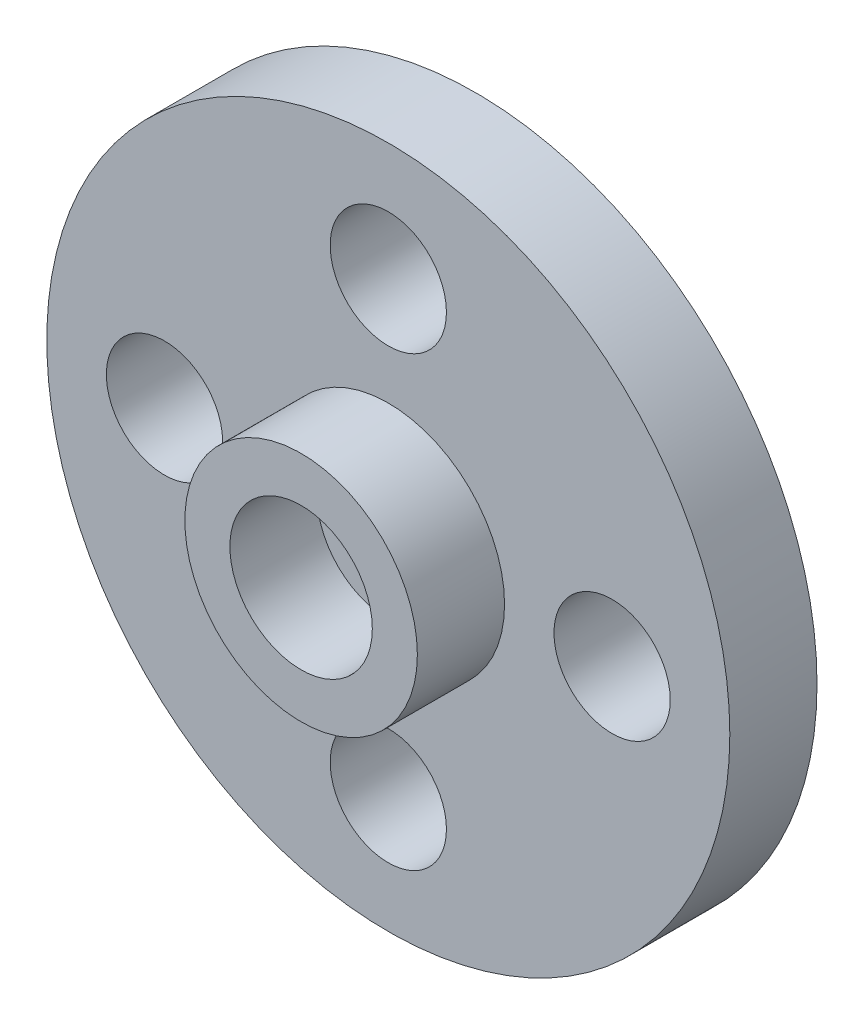
from build123d import *

# Parameters (mm, degrees)
SKIZZE1_R                       = 11.75
AUFSATZ_LINEAR_AUSTRAGEN1_DEPTH = 3
SKIZZE2_R                       = 4
SKIZZE2_R_2                     = 2.45
AUFSATZ_LINEAR_AUSTRAGEN2_DEPTH = 3
SCHNITT_LINEAR_AUSTRAGEN1_REACH = 18.886
SKIZZE3_R                       = 2


with BuildPart() as part:
    # Skizze1 → Aufsatz-Linear austragen1 (new body)
    with BuildSketch(Plane.XY):
        Circle(SKIZZE1_R)
    extrude(amount=-AUFSATZ_LINEAR_AUSTRAGEN1_DEPTH)

    # Skizze2 → Aufsatz-Linear austragen2 (add)
    with BuildSketch(Plane.XY):
        Circle(SKIZZE2_R)
        Circle(SKIZZE2_R_2, mode=Mode.SUBTRACT)
    extrude(amount=AUFSATZ_LINEAR_AUSTRAGEN2_DEPTH)

    # Skizze3 → Schnitt-Linear austragen1 (cut, up to next)
    with BuildSketch(Plane.XY, mode=Mode.PRIVATE) as schnitt_linear_austragen1_sk1:
        with Locations((0, 7.7)):
            Circle(SKIZZE3_R)
    schnitt_linear_austragen1_tool1 = extrude(schnitt_linear_austragen1_sk1.sketch, amount=-SCHNITT_LINEAR_AUSTRAGEN1_REACH, mode=Mode.PRIVATE) & part.part
    # Skizze3 → Schnitt-Linear austragen1 (cut, up to next)
    with BuildSketch(Plane.XY, mode=Mode.PRIVATE) as schnitt_linear_austragen1_sk2:
        with Locations((7.7, 0)):
            Circle(SKIZZE3_R)
    schnitt_linear_austragen1_tool2 = extrude(schnitt_linear_austragen1_sk2.sketch, amount=-SCHNITT_LINEAR_AUSTRAGEN1_REACH, mode=Mode.PRIVATE) & part.part
    # Skizze3 → Schnitt-Linear austragen1 (cut, up to next)
    with BuildSketch(Plane.XY, mode=Mode.PRIVATE) as schnitt_linear_austragen1_sk3:
        with Locations((0, -7.7)):
            Circle(SKIZZE3_R)
    schnitt_linear_austragen1_tool3 = extrude(schnitt_linear_austragen1_sk3.sketch, amount=-SCHNITT_LINEAR_AUSTRAGEN1_REACH, mode=Mode.PRIVATE) & part.part
    # Skizze3 → Schnitt-Linear austragen1 (cut, up to next)
    with BuildSketch(Plane.XY, mode=Mode.PRIVATE) as schnitt_linear_austragen1_sk4:
        with Locations((-7.7, 0)):
            Circle(SKIZZE3_R)
    schnitt_linear_austragen1_tool4 = extrude(schnitt_linear_austragen1_sk4.sketch, amount=-SCHNITT_LINEAR_AUSTRAGEN1_REACH, mode=Mode.PRIVATE) & part.part
    add(schnitt_linear_austragen1_tool1.solids().sort_by_distance((0, 7.7, 0))[0], mode=Mode.SUBTRACT)
    add(schnitt_linear_austragen1_tool2.solids().sort_by_distance((7.7, 0, 0))[0], mode=Mode.SUBTRACT)
    add(schnitt_linear_austragen1_tool3.solids().sort_by_distance((0, -7.7, 0))[0], mode=Mode.SUBTRACT)
    add(schnitt_linear_austragen1_tool4.solids().sort_by_distance((-7.7, 0, 0))[0], mode=Mode.SUBTRACT)


solid = part.part
